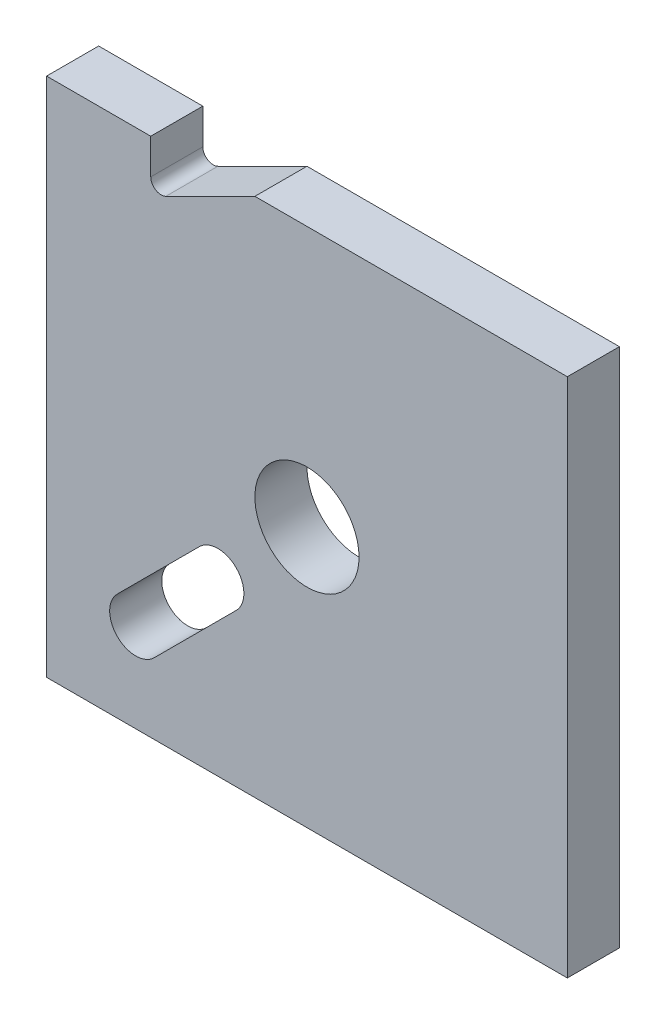
from build123d import *

# Parameters (mm, degrees)
SKETCH1_W               = 50
SKETCH1_H               = 50
SKETCH1_R               = 5
BOSS_EXTRUDE1_DEPTH     = 2.5
CUT_EXTRUDE2_DEPTH      = 36.707142143
CUT_EXTRUDE2_DEPTH_BACK = 5
FILLET1_R               = 1
CUT_EXTRUDE3_DEPTH      = 36.707142143


with BuildPart() as part:
    # Sketch1 → Boss-Extrude1 (new, symmetric)
    with BuildSketch(Plane.XY):
        Rectangle(SKETCH1_W, SKETCH1_H)
        Circle(SKETCH1_R, mode=Mode.SUBTRACT)
    extrude(amount=BOSS_EXTRUDE1_DEPTH, both=True)

    # Sketch4 → Cut-Extrude2 (cut, two sides: drawn at the far end of the back side and taken through both)
    with BuildSketch(Plane.XY.offset(2.5).offset(-CUT_EXTRUDE2_DEPTH_BACK)):
        Polygon((-5, 25), (-15, 25), (-15, 20), align=None)
    extrude(amount=CUT_EXTRUDE2_DEPTH + CUT_EXTRUDE2_DEPTH_BACK, mode=Mode.SUBTRACT)

    # Fillet1
    fillet1_edges = [part.edges().sort_by_distance(p)[0] for p in [
        (-15, 20, 0),
    ]]
    fillet(fillet1_edges, radius=FILLET1_R)

    # Sketch5 → Cut-Extrude3 (cut, through all)
    with BuildSketch(Plane.XY.offset(2.5)):
        with BuildLine():
            Line((-6.790302071, -10.325835977), (-14.674164023, -18.209697929))
            ThreePointArc((-14.674164023, -18.209697929), (-18.209697929, -18.209697929), (-18.209697929, -14.674164023))
            Line((-18.209697929, -14.674164023), (-10.325835977, -6.790302071))
            ThreePointArc((-10.325835977, -6.790302071), (-6.790302071, -6.790302071), (-6.790302071, -10.325835977))
        make_face()
    extrude(amount=-CUT_EXTRUDE3_DEPTH, mode=Mode.SUBTRACT)


solid = part.part
